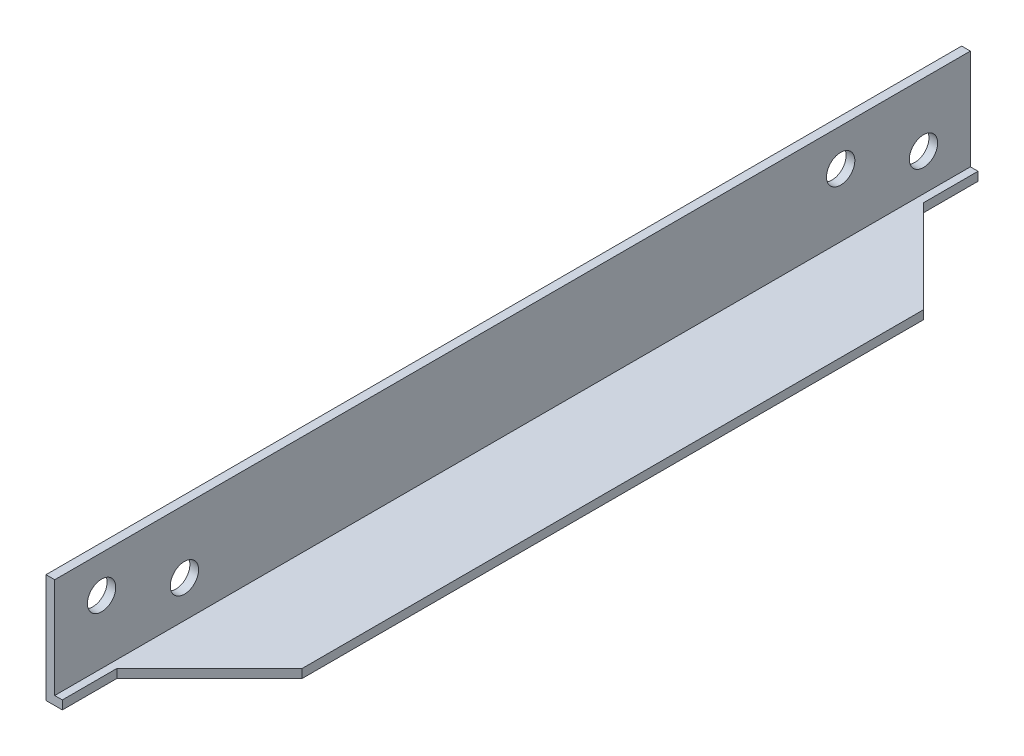
from build123d import *

# Parameters (mm, degrees)
SKETCH_1_W          = 100
SKETCH_1_H          = 100
EXTRUDE_1_DEPTH     = 840
SKETCH_2_W          = 92
SKETCH_2_H          = 92
CUT_EXTRUDE_1_DEPTH = 852.821577562
SKETCH_3_R          = 13
CUT_EXTRUDE_2_DEPTH = 852.821577562
CUT_EXTRUDE_3_DEPTH = 851.919502656


with BuildPart() as part:
    # 草图1 → 凸台-拉伸1 (new body)
    with BuildSketch(Plane.XY):
        with Locations((50, 50)):
            Rectangle(SKETCH_1_W, SKETCH_1_H)
    extrude(amount=EXTRUDE_1_DEPTH)

    # 草图2 → 切除-拉伸1 (cut, through all)
    with BuildSketch(Plane.XY.offset(840)):
        with Locations((54, 54)):
            Rectangle(SKETCH_2_W, SKETCH_2_H)
    extrude(amount=-CUT_EXTRUDE_1_DEPTH, mode=Mode.SUBTRACT)

    # 草图3 → 切除-拉伸2 (cut, through all)
    with BuildSketch(Plane.ZY):
        with Locations((43, 42)):
            Circle(SKETCH_3_R)
        with Locations((119, 66)):
            Circle(SKETCH_3_R)
        with Locations((797, 66)):
            Circle(SKETCH_3_R)
        with Locations((721, 42)):
            Circle(SKETCH_3_R)
    extrude(amount=-CUT_EXTRUDE_2_DEPTH, mode=Mode.SUBTRACT)

    # 草图4 → 切除-拉伸3 (cut, through all)
    with BuildSketch(Plane(origin=(0, 8, 0), x_dir=(1, 0, 0), z_dir=(0, 1, 0))):
        Polygon((15, 0), (15, -50), (100, -135), (100, 0), align=None)
        Polygon((15, -840), (15, -790), (100, -705), (100, -840), align=None)
    extrude(amount=-CUT_EXTRUDE_3_DEPTH, mode=Mode.SUBTRACT)


solid = part.part
